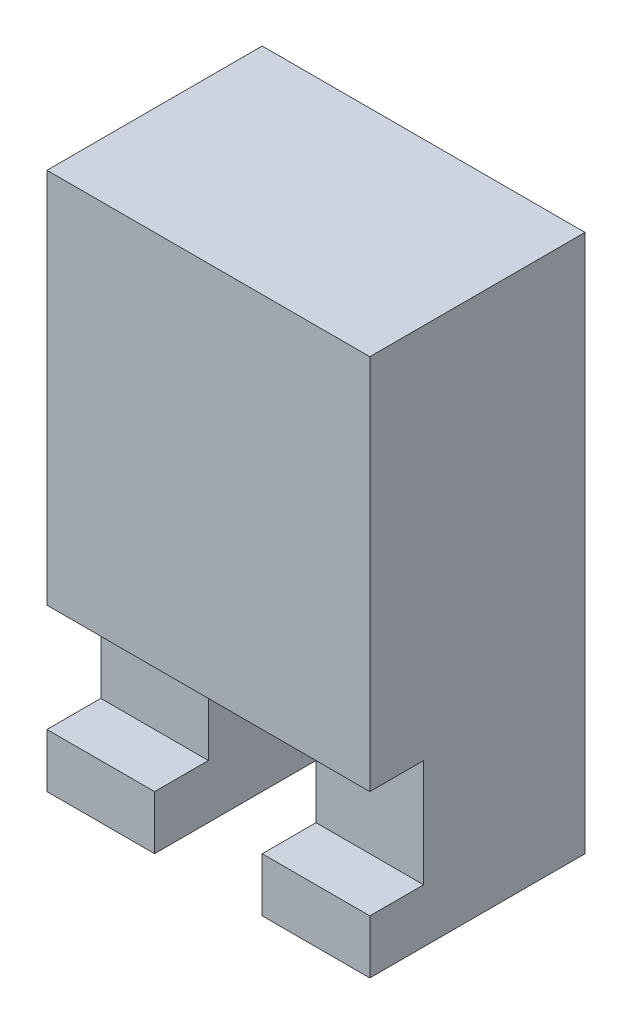
from build123d import *

# Parameters (mm, degrees)
SKETCH2_W           = 3
SKETCH2_H           = 2
BOSS_EXTRUDE1_DEPTH = 5
SKETCH3_W           = 3
SKETCH3_H           = 1
CUT_EXTRUDE1_DEPTH  = 0.5
SKETCH4_W           = 1
SKETCH4_H           = 1.5
CUT_EXTRUDE2_DEPTH  = 5


with BuildPart() as part:
    # Sketch2 → Boss-Extrude1 (new body)
    with BuildSketch(Plane(origin=(0, 0, 0), x_dir=(1, 0, 0), z_dir=(0, 1, 0))):
        Rectangle(SKETCH2_W, SKETCH2_H)
    extrude(amount=BOSS_EXTRUDE1_DEPTH)

    # Sketch3 → Cut-Extrude1 (cut)
    with BuildSketch(Plane.XY.offset(1)):
        with Locations((0, 1)):
            Rectangle(SKETCH3_W, SKETCH3_H)
    extrude(amount=-CUT_EXTRUDE1_DEPTH, mode=Mode.SUBTRACT)

    # Sketch4 → Cut-Extrude2 (cut)
    with BuildSketch(Plane(origin=(0, 0, -1), x_dir=(-1, 0, 0), z_dir=(0, 0, -1))):
        with Locations((0, 0.75)):
            Rectangle(SKETCH4_W, SKETCH4_H)
    extrude(amount=-CUT_EXTRUDE2_DEPTH, mode=Mode.SUBTRACT)


solid = part.part
